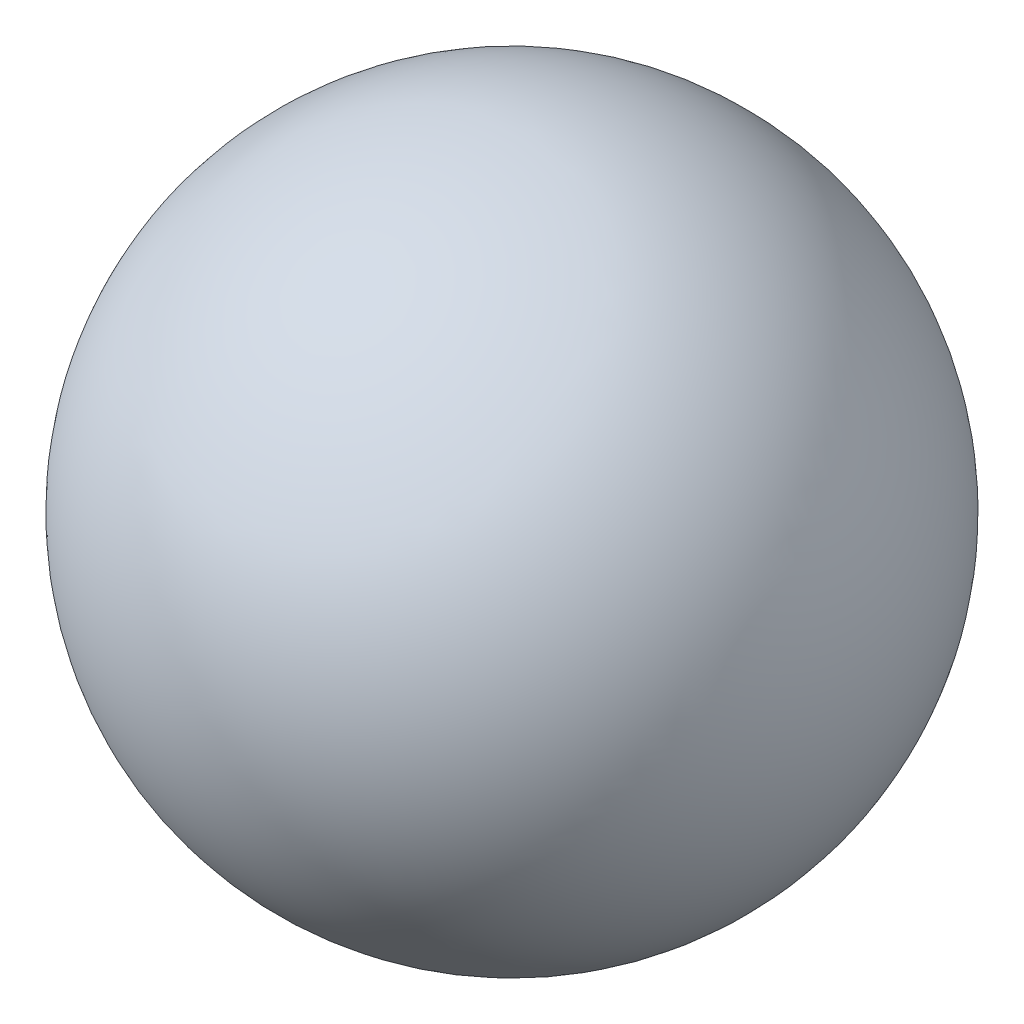
from build123d import *


with BuildPart() as part:
    # Sketch1 → Revolve1 (revolve)
    with BuildSketch(Plane.XY):
        with BuildLine():
            Line((-19.05, 0), (19.05, 0))
            ThreePointArc((19.05, 0), (0, 19.05), (-19.05, 0))
        make_face()
    revolve(axis=Axis((-19.05, 0, 0), (1, 0, 0)))


solid = part.part
